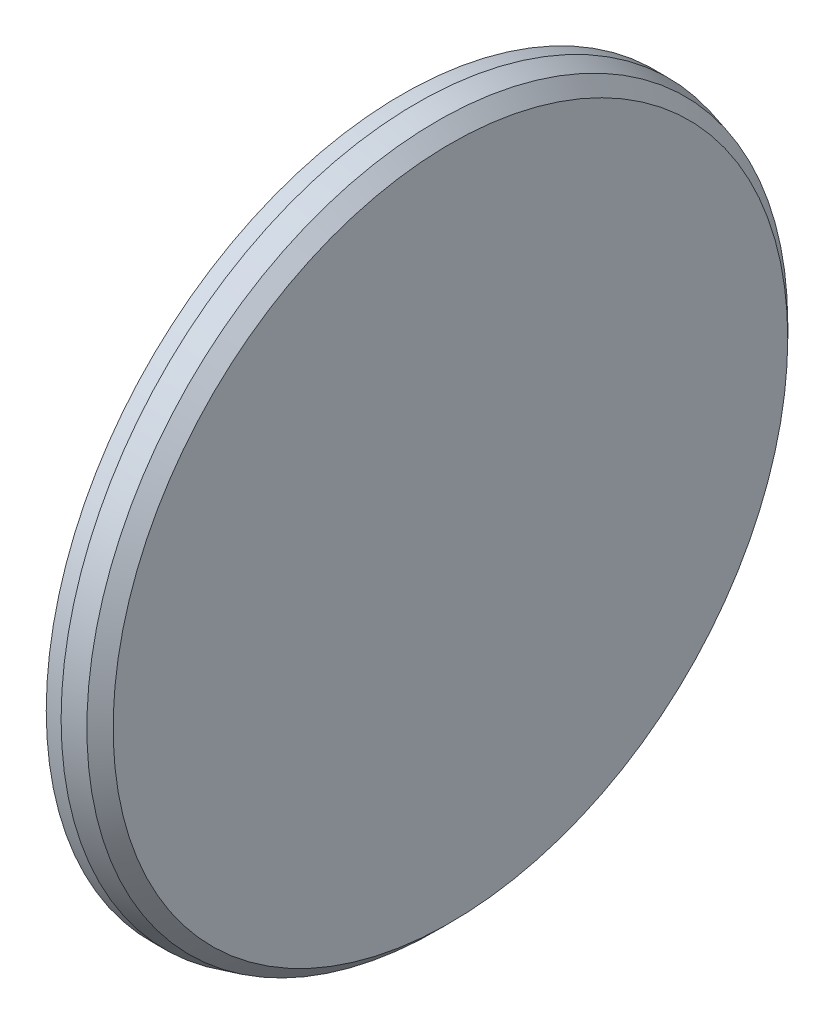
from build123d import *

# Parameters (mm, degrees)
BOSS_EXTRUDE1_DEPTH = 25


with BuildPart() as part:
    # Sketch1 → Revolve1 (revolve)
    with BuildSketch(Plane(origin=(0, 0, 0), x_dir=(1, 0, 0), z_dir=(0, 1, 0))):
        Polygon((-85, 0), (-85, 100), (-30, 100), (-30, 433.75), (-65, 433.75), (-65, 478.75), (-45, 478.75), (-17.679491924, 471.429491924), (0, 453.75), (0, 0), align=None)
    revolve(axis=Axis((0, 0, 0), (-1, 0, 0)))

    # Sketch2 → Boss-Extrude1 (add)
    with BuildSketch(Plane.ZY.offset(30)):
        with BuildLine():
            Line((20, 105.830052443), (20, 422.686719096))
            ThreePointArc((20, 422.686719096), (23.183829742, 430.003810253), (30.707964602, 432.661626921))
            ThreePointArc((30.707964602, 432.661626921), (-31.38909354, 432.612745197), (-92.842809365, 423.697150391))
            ThreePointArc((-92.842809365, 423.697150391), (-42.387293117, 411.834770603), (-20, 365.087746302))
            Line((-20, 365.087746302), (-20, 105.830052443))
            ThreePointArc((-20, 105.830052443), (-22.022759648, 99.799825551), (-27.272727273, 96.209138584))
            ThreePointArc((-27.272727273, 96.209138584), (0, 100), (27.272727273, 96.209138584))
            ThreePointArc((27.272727273, 96.209138584), (22.022759648, 99.799825551), (20, 105.830052443))
        make_face()
        with BuildLine():
            Line((83.347135305, 68.214771395), (287.018674676, 310.94106015))
            ThreePointArc((287.018674676, 310.94106015), (294.160965293, 314.499750862), (301.633198614, 311.699335889))
            ThreePointArc((301.633198614, 311.699335889), (254.032671724, 351.577109888), (201.225560333, 384.24905513))
            ThreePointArc((201.225560333, 384.24905513), (232.25173743, 342.729764327), (219.352990909, 292.529191499))
            Line((219.352990909, 292.529191499), (52.70535758, 93.926275782))
            ThreePointArc((52.70535758, 93.926275782), (47.279678663, 90.60705882), (40.949921045, 91.231047163))
            ThreePointArc((40.949921045, 91.231047163), (64.278760969, 76.604444312), (82.734163396, 56.169904816))
            ThreePointArc((82.734163396, 56.169904816), (81.020503963, 62.295144755), (83.347135305, 68.214771395))
        make_face()
        with BuildLine():
            Line((107.6952197, -1.318959311), (419.738121614, 53.702623435))
            ThreePointArc((419.738121614, 53.702623435), (427.496915948, 51.837762766), (431.420906716, 44.889461442))
            ThreePointArc((431.420906716, 44.889461442), (420.58972663, 106.034637518), (401.138253978, 165.006556522))
            ThreePointArc((401.138253978, 165.006556522), (398.217598843, 113.257692306), (356.068279535, 83.092976894))
            Line((356.068279535, 83.092976894), (100.749292594, 38.073350809))
            ThreePointArc((100.749292594, 38.073350809), (94.459429872, 39.018242282), (90.011646197, 43.564934854))
            ThreePointArc((90.011646197, 43.564934854), (98.480775301, 17.364817767), (99.483364979, -10.151851674))
            ThreePointArc((99.483364979, -10.151851674), (102.107854032, -4.358126605), (107.6952197, -1.318959311))
        make_face()
        with BuildLine():
            Line((81.651513899, -70.235534297), (356.057436579, -228.663867624))
            ThreePointArc((356.057436579, -228.663867624), (360.802308533, -235.07969064), (359.341977855, -242.924690904))
            ThreePointArc((359.341977855, -242.924690904), (390.348174112, -189.122620191), (413.353900432, -131.444343727))
            ThreePointArc((413.353900432, -131.444343727), (377.853020062, -169.208912664), (326.175262908, -165.223365075))
            Line((326.175262908, -165.223365075), (101.651513899, -35.594518146))
            ThreePointArc((101.651513899, -35.594518146), (97.440564044, -30.827643459), (96.955921726, -24.485694643))
            ThreePointArc((96.955921726, -24.485694643), (86.602540378, -50), (69.683194454, -71.723443941))
            ThreePointArc((69.683194454, -71.723443941), (75.417804397, -68.972182092), (81.651513899, -70.235534297))
        make_face()
        with BuildLine():
            Line((17.402157289, -106.288122204), (125.773519831, -404.035993705))
            ThreePointArc((125.773519831, -404.035993705), (125.284291084, -412.000744176), (119.122943915, -417.071680569))
            ThreePointArc((119.122943915, -417.071680569), (177.45837269, -395.787302048), (232.156662956, -366.390974705))
            ThreePointArc((232.156662956, -366.390974705), (180.686813825, -372.500786851), (143.661215732, -336.229858273))
            Line((143.661215732, -336.229858273), (54.98986212, -92.607316471))
            ThreePointArc((54.98986212, -92.607316471), (54.828175369, -86.248932215), (58.533443935, -81.079195489))
            ThreePointArc((58.533443935, -81.079195489), (34.202014333, -93.969262079), (7.277482801, -99.73483967))
            ThreePointArc((7.277482801, -99.73483967), (13.438925908, -101.313387037), (17.402157289, -106.288122204))
        make_face()
        with BuildLine():
            Line((-54.98986212, -92.607316471), (-163.361224663, -390.355187972))
            ThreePointArc((-163.361224663, -390.355187972), (-168.855638543, -396.142070634), (-176.835039387, -396.066195661))
            ThreePointArc((-176.835039387, -396.066195661), (-118.466173544, -417.258706591), (-57.66925725, -429.899196636))
            ThreePointArc((-57.66925725, -429.899196636), (-101.024760711, -401.495402985), (-106.073510901, -349.910664006))
            Line((-106.073510901, -349.910664006), (-17.402157289, -106.288122204))
            ThreePointArc((-17.402157289, -106.288122204), (-13.438925908, -101.313387037), (-7.277482801, -99.73483967))
            ThreePointArc((-7.277482801, -99.73483967), (-34.202014333, -93.969262079), (-58.533443935, -81.079195489))
            ThreePointArc((-58.533443935, -81.079195489), (-54.828175369, -86.248932215), (-54.98986212, -92.607316471))
        make_face()
        with BuildLine():
            Line((-101.651513899, -35.594518146), (-376.057436579, -194.022851472))
            ThreePointArc((-376.057436579, -194.022851472), (-383.986138274, -194.924119613), (-390.049942457, -189.736936017))
            ThreePointArc((-390.049942457, -189.736936017), (-358.959080571, -243.490125006), (-320.511091067, -292.252806664))
            ThreePointArc((-320.511091067, -292.252806664), (-335.465726945, -242.625857938), (-306.175262908, -199.864381227))
            Line((-306.175262908, -199.864381227), (-81.651513899, -70.235534297))
            ThreePointArc((-81.651513899, -70.235534297), (-75.417804397, -68.972182092), (-69.683194454, -71.723443941))
            ThreePointArc((-69.683194454, -71.723443941), (-86.602540378, -50), (-96.955921726, -24.485694643))
            ThreePointArc((-96.955921726, -24.485694643), (-97.440564044, -30.827643459), (-101.651513899, -35.594518146))
        make_face()
        with BuildLine():
            Line((-100.749292594, 38.073350809), (-412.792194508, 93.094933555))
            ThreePointArc((-412.792194508, 93.094933555), (-419.445256376, 97.500993314), (-420.75614253, 105.37234468))
            ThreePointArc((-420.75614253, 105.37234468), (-431.491044414, 44.21019216), (-433.38222329, -17.858080426))
            ThreePointArc((-433.38222329, -17.858080426), (-412.938551255, 29.771022524), (-363.014206641, 43.700666774))
            Line((-363.014206641, 43.700666774), (-107.6952197, -1.318959311))
            ThreePointArc((-107.6952197, -1.318959311), (-102.107854032, -4.358126605), (-99.483364979, -10.151851674))
            ThreePointArc((-99.483364979, -10.151851674), (-98.480775301, 17.364817767), (-90.011646197, 43.564934854))
            ThreePointArc((-90.011646197, 43.564934854), (-94.459429872, 39.018242282), (-100.749292594, 38.073350809))
        make_face()
        with BuildLine():
            Line((-52.70535758, 93.926275782), (-256.376896951, 336.652564537))
            ThreePointArc((-256.376896951, 336.652564537), (-258.641277405, 344.304307868), (-254.585867329, 351.176734218))
            ThreePointArc((-254.585867329, 351.176734218), (-302.123553086, 311.224069073), (-343.468996728, 264.892640114))
            ThreePointArc((-343.468996728, 264.892640114), (-297.192838133, 288.237710679), (-249.994768634, 266.817687112))
            Line((-249.994768634, 266.817687112), (-83.347135305, 68.214771395))
            ThreePointArc((-83.347135305, 68.214771395), (-81.020503963, 62.295144755), (-82.734163396, 56.169904816))
            ThreePointArc((-82.734163396, 56.169904816), (-64.278760969, 76.604444312), (-40.949921045, 91.231047163))
            ThreePointArc((-40.949921045, 91.231047163), (-47.279678663, 90.60705882), (-52.70535758, 93.926275782))
        make_face()
    extrude(amount=BOSS_EXTRUDE1_DEPTH)


solid = part.part
